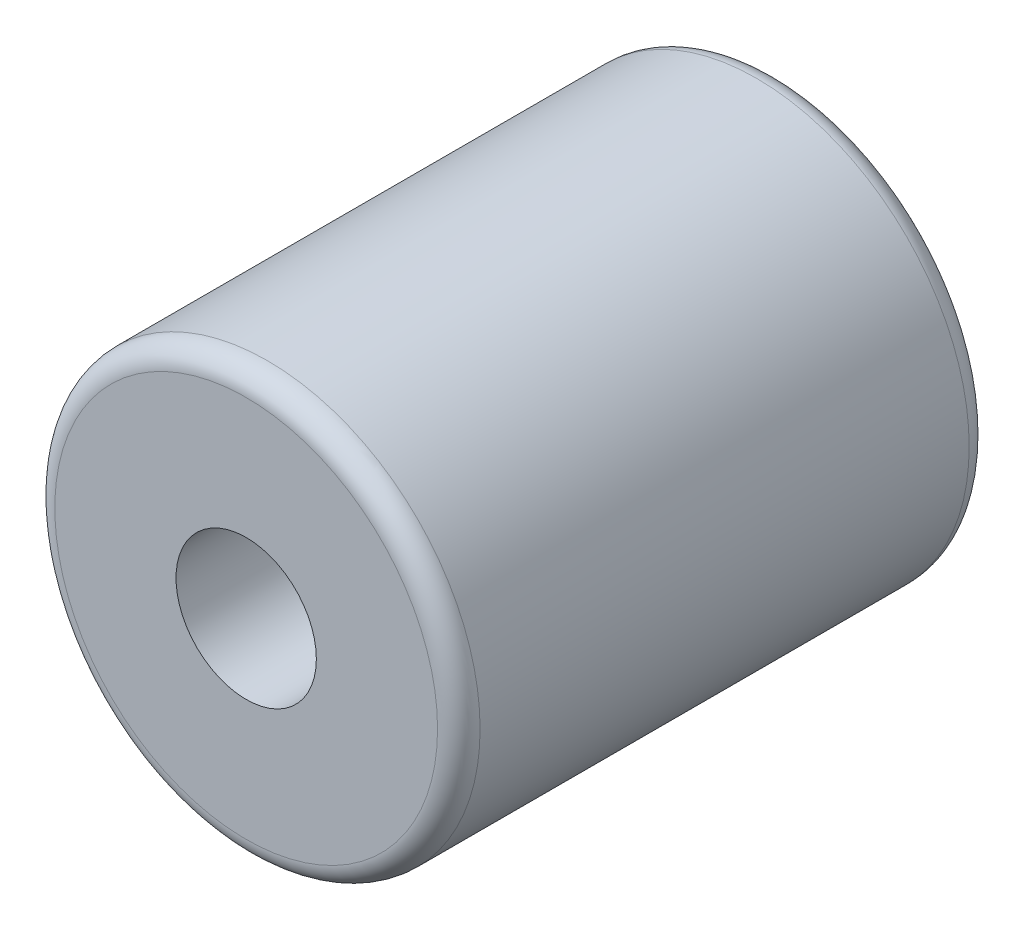
from build123d import *

# Parameters (mm, degrees)
SKETCH_1_R          = 10
EXTRUDE_1_DEPTH     = 25
SKETCH_2_R          = 3.3
CUT_EXTRUDE_1_DEPTH = 12
FILLET_1_R          = 1
SKETCH_3_R          = 2
CUT_EXTRUDE_2_DEPTH = 29.722813268


with BuildPart() as part:
    # 草图1 → 凸台-拉伸1 (new body)
    with BuildSketch(Plane.XY):
        Circle(SKETCH_1_R)
    extrude(amount=EXTRUDE_1_DEPTH)

    # 草图2 → 切除-拉伸1 (cut)
    with BuildSketch(Plane.XY.offset(25)):
        Circle(SKETCH_2_R)
    extrude(amount=-CUT_EXTRUDE_1_DEPTH, mode=Mode.SUBTRACT)

    # 圆角1
    fillet_1_edges = [part.edges().sort_by_distance(p)[0] for p in [
        (-10, 0, 0),
        (-10, 0, 25),
    ]]
    fillet(fillet_1_edges, radius=FILLET_1_R)

    # 草图3 → 切除-拉伸2 (cut, through all)
    with BuildSketch(Plane(origin=(0, 0, 0), x_dir=(-1, 0, 0), z_dir=(0, 0, -1))):
        Circle(SKETCH_3_R)
    extrude(amount=-CUT_EXTRUDE_2_DEPTH, mode=Mode.SUBTRACT)


solid = part.part
